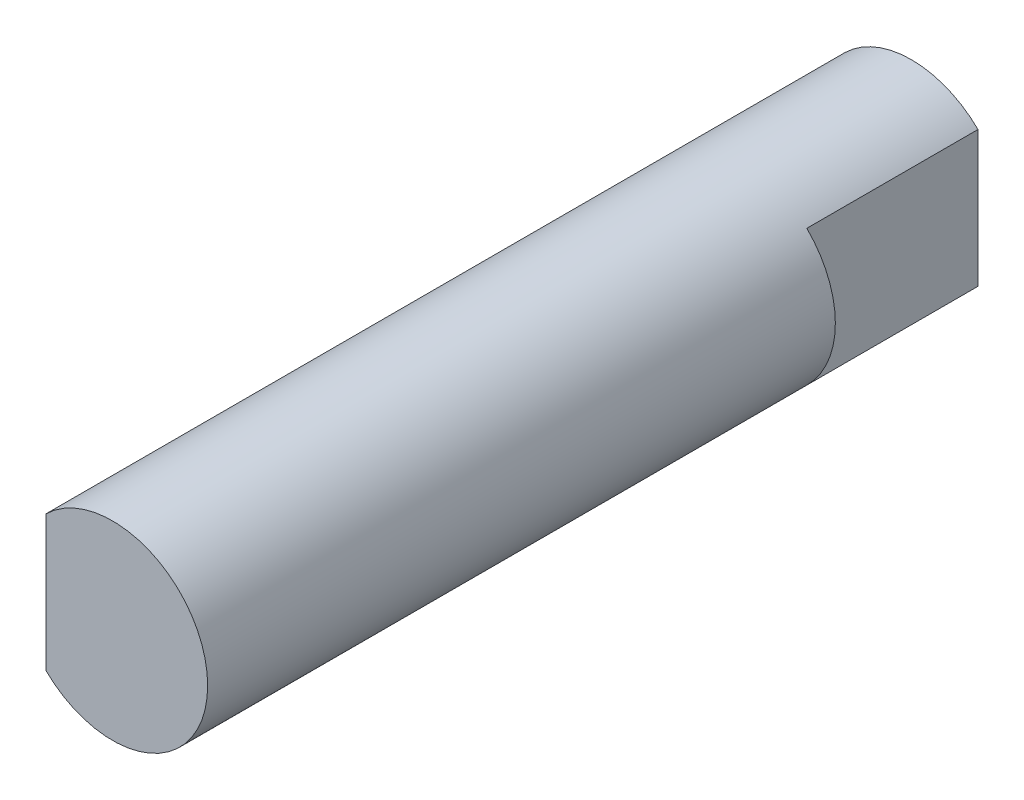
from build123d import *

# Parameters (mm, degrees)
SKETCH1_R           = 2.5
BOSS_EXTRUDE1_DEPTH = 21
CUT_EXTRUDE2_DEPTH  = 4.5
SKETCH3_R           = 1
CUT_EXTRUDE3_DEPTH  = 6
CUT_EXTRUDE4_START  = -4.5
CUT_EXTRUDE4_DEPTH  = 4.5


with BuildPart() as part:
    # Sketch1 → Boss-Extrude1 (new body)
    with BuildSketch(Plane.XY):
        with Locations(Location((0, 0, 0), (0, 0, 180))):
            Circle(SKETCH1_R)
    extrude(amount=BOSS_EXTRUDE1_DEPTH)

    # Sketch2 → Cut-Extrude2 (cut)
    with BuildSketch(Plane(origin=(0, 0, 0), x_dir=(-1, 0, 0), z_dir=(0, 0, -1))):
        with BuildLine():
            Line((-1.75, -1.785357107), (-1.75, 1.785357107))
            ThreePointArc((-1.75, 1.785357107), (-2.5, 0), (-1.75, -1.785357107))
        make_face()
        with BuildLine():
            Line((1.75, -1.785357107), (1.75, 1.785357107))
            ThreePointArc((1.75, 1.785357107), (2.5, 0), (1.75, -1.785357107))
        make_face()
    extrude(amount=-CUT_EXTRUDE2_DEPTH, mode=Mode.SUBTRACT)

    # Sketch3 → Cut-Extrude3 (cut)
    with BuildSketch(Plane(origin=(0, 0, 0), x_dir=(-1, 0, 0), z_dir=(0, 0, -1))):
        Circle(SKETCH3_R)
    extrude(amount=-CUT_EXTRUDE3_DEPTH, mode=Mode.SUBTRACT)

    # Sketch4 → Cut-Extrude4 (cut)
    with BuildSketch(Plane.XY.offset(21).offset(CUT_EXTRUDE4_START)):
        with BuildLine():
            Line((-1.75, -1.785357107), (-1.75, 1.785357107))
            ThreePointArc((-1.75, 1.785357107), (-2.5, 0), (-1.75, -1.785357107))
        make_face()
    extrude(amount=CUT_EXTRUDE4_DEPTH, mode=Mode.SUBTRACT)


solid = part.part
